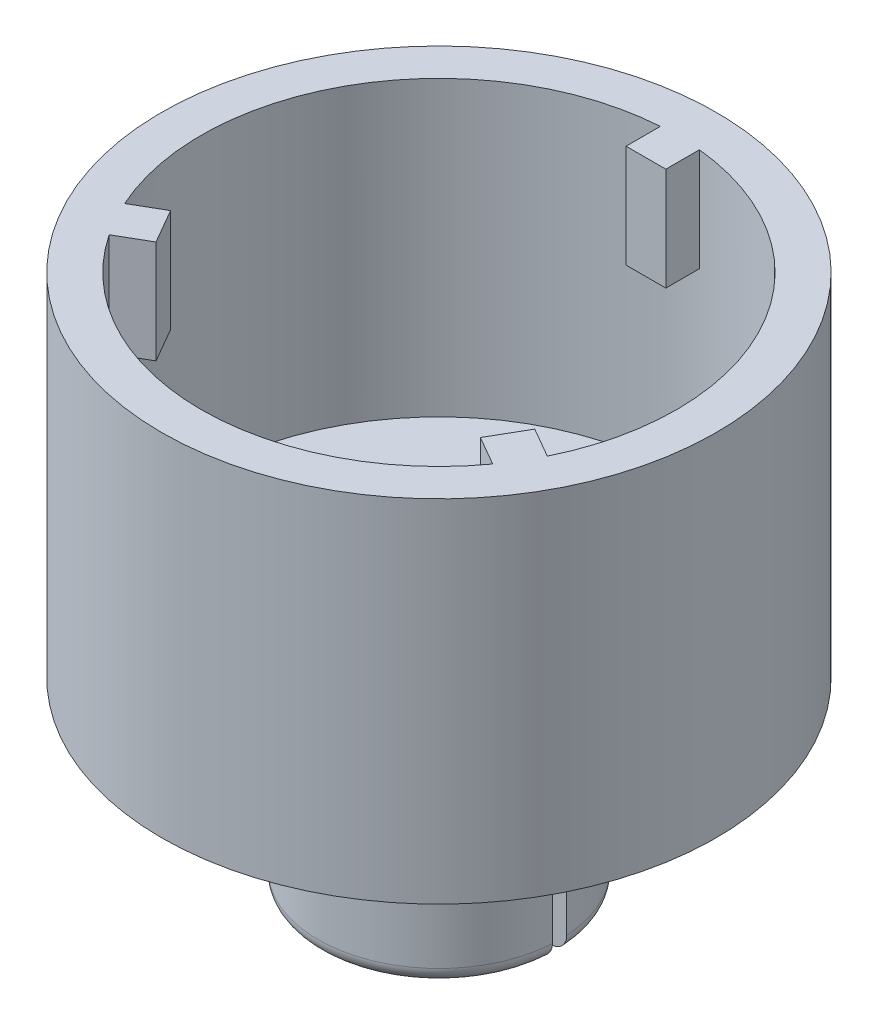
from build123d import *

# Parameters (mm, degrees)
SKETCH1_R           = 35
BOSS_EXTRUDE1_DEPTH = 44.3
SKETCH2_R           = 30
CUT_EXTRUDE1_DEPTH  = 37
SKETCH3_R           = 19.5
BOSS_EXTRUDE2_DEPTH = 7
SKETCH4_R           = 15.25
BOSS_EXTRUDE3_DEPTH = 16
FILLET1_R           = 5
BOSS_EXTRUDE4_DEPTH = 13
SKETCH7_W           = 66.193685288
SKETCH7_H           = 1.806726502
CUT_EXTRUDE2_DEPTH  = 16
FILLET2_R           = 2


with BuildPart() as part:
    # Sketch1 → Boss-Extrude1 (new body)
    with BuildSketch(Plane(origin=(0, 0, 0), x_dir=(1, 0, 0), z_dir=(0, 1, 0))):
        with Locations(Location((0, 0, 0), (0, 0, 270))):
            Circle(SKETCH1_R)
    extrude(amount=BOSS_EXTRUDE1_DEPTH)

    # Sketch2 → Cut-Extrude1 (cut)
    with BuildSketch(Plane(origin=(0, 44.3, 0), x_dir=(1, 0, 0), z_dir=(0, 1, 0))):
        with Locations(Location((0, 0, 0), (0, 0, 270))):
            Circle(SKETCH2_R)
    extrude(amount=-CUT_EXTRUDE1_DEPTH, mode=Mode.SUBTRACT)

    # Sketch3 → Boss-Extrude2 (add)
    with BuildSketch(Plane.XZ):
        with Locations(Location((0, 0, 0), (0, 0, 270))):
            Circle(SKETCH3_R)
    extrude(amount=BOSS_EXTRUDE2_DEPTH)

    # Sketch4 → Boss-Extrude3 (add)
    with BuildSketch(Plane.XZ.offset(7)):
        with Locations(Location((0, 0, 0), (0, 0, 270))):
            Circle(SKETCH4_R)
    extrude(amount=BOSS_EXTRUDE3_DEPTH)

    # Fillet1
    fillet1_edges = [part.edges().sort_by_distance(p)[0] for p in [
        (0, 0, 19.5),
    ]]
    fillet(fillet1_edges, radius=FILLET1_R)

    # Sketch5 → Boss-Extrude4 (add)
    with BuildSketch(Plane(origin=(0, 44.3, 0), x_dir=(1, 0, 0), z_dir=(0, 1, 0))):
        with BuildLine():
            Line((-1.990534123, 29.933890056), (-1.990534123, 25.605317076))
            Line((-1.990534123, 25.605317076), (3.030233114, 25.605317076))
            Line((3.030233114, 25.605317076), (3.030233114, 29.846569104))
            ThreePointArc((3.030233114, 29.846569104), (0.521679725, 29.995463828), (-1.990534123, 29.933890056))
        make_face()
        with BuildLine():
            Line((26.918776284, -13.243091911), (23.170122121, -11.07880542))
            Line((23.170122121, -11.07880542), (20.659738503, -15.426917394))
            Line((20.659738503, -15.426917394), (24.332770503, -17.547543408))
            ThreePointArc((24.332770503, -17.547543408), (25.715993811, -15.449519808), (26.918776284, -13.243091911))
        make_face()
        with BuildLine():
            Line((-24.928242161, -16.690798146), (-21.179587998, -14.526511655))
            Line((-21.179587998, -14.526511655), (-23.689971616, -10.178399682))
            Line((-23.689971616, -10.178399682), (-27.363003617, -12.299025696))
            ThreePointArc((-27.363003617, -12.299025696), (-26.237673536, -14.54594402), (-24.928242161, -16.690798146))
        make_face()
    extrude(amount=-BOSS_EXTRUDE4_DEPTH)

    # Sketch7 → Cut-Extrude2 (cut)
    with BuildSketch(Plane.XZ.offset(23)):
        Rectangle(SKETCH7_W, SKETCH7_H)
    extrude(amount=-CUT_EXTRUDE2_DEPTH, mode=Mode.SUBTRACT)

    # Fillet2
    fillet2_edges = [part.edges().sort_by_distance(p)[0] for p in [
        (0, -23, 15.25),
        (0, -23, -15.25),
    ]]
    fillet(fillet2_edges, radius=FILLET2_R)


solid = part.part
